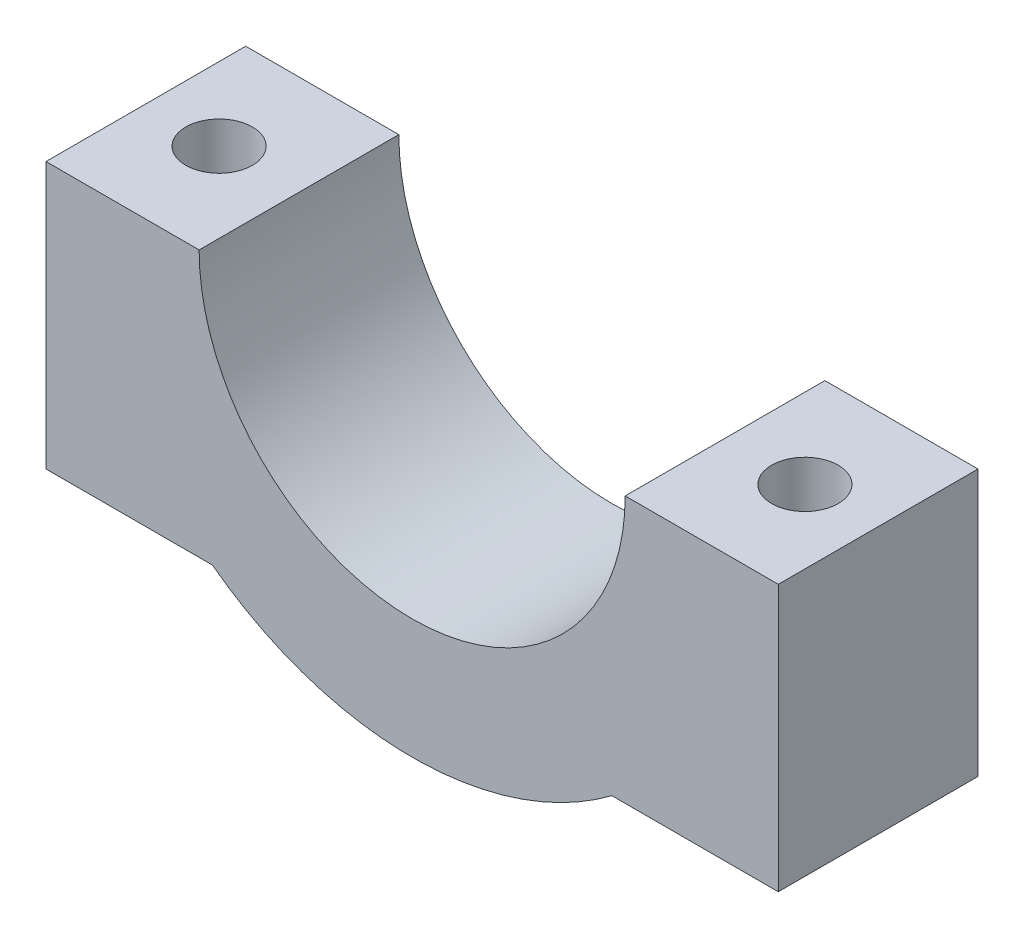
from build123d import *

# Parameters (mm, degrees)
BOSS_EXTRUDE1_DEPTH      = 7.5
BOSS_EXTRUDE1_DEPTH_BACK = 7.5
TAP_DRILL_FOR_M6_TAP1_D  = 5


with BuildPart() as part:
    # Sketch1 → Boss-Extrude1 (new, two sides: drawn at the far end of the back side and taken through both)
    with BuildSketch(Plane.XY.offset(-BOSS_EXTRUDE1_DEPTH_BACK)):
        with BuildLine():
            Line((-27.5, 0), (-16, 0))
            ThreePointArc((-16, 0), (0, -16), (16, 0))
            Line((16, 0), (27.5, 0))
            Line((27.5, 0), (27.5, -20))
            Line((27.5, -20), (15, -20))
            ThreePointArc((15, -20), (0, -25), (-15, -20))
            Line((-15, -20), (-27.5, -20))
            Line((-27.5, -20), (-27.5, 0))
        make_face()
    extrude(amount=BOSS_EXTRUDE1_DEPTH + BOSS_EXTRUDE1_DEPTH_BACK)

    # Tap Drill for M6 Tap1 (through all)
    with Locations(Plane(origin=(0, -20, 0), x_dir=(-1, 0, 0), z_dir=(0, -1, 0))):
        with Locations((22, 0), (-22, 0)):
            Hole(TAP_DRILL_FOR_M6_TAP1_D / 2)


solid = part.part
